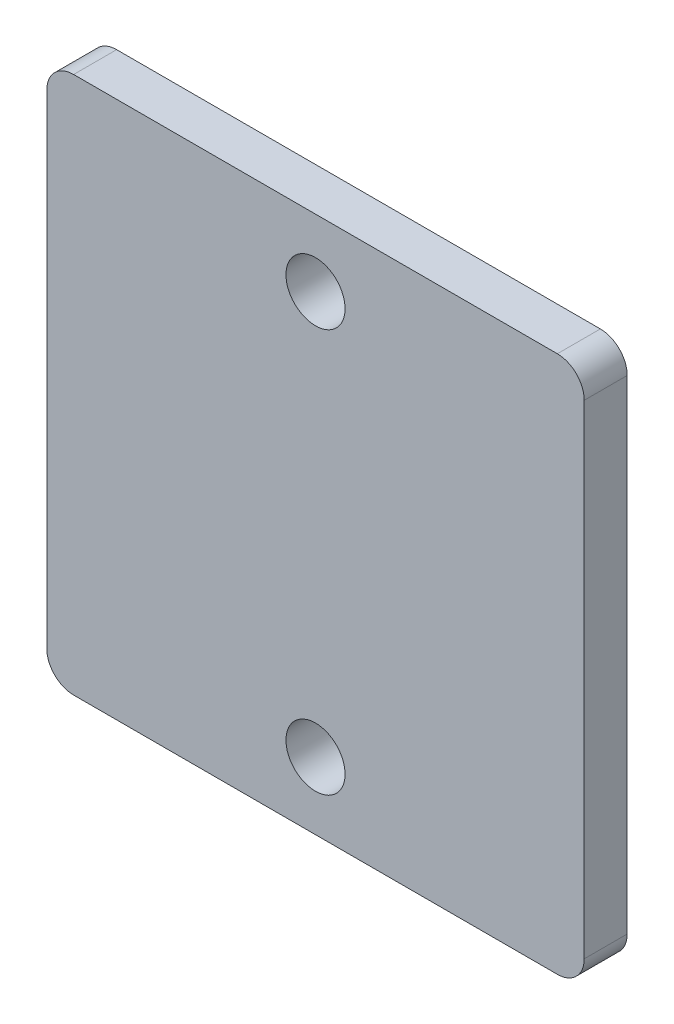
from build123d import *

# Parameters (mm, degrees)
SKETCH_1_R                             = 1.1
PCB20X20_T1P6_2NPTH_D2P2_PITCH15_DEPTH = 1.6


with BuildPart() as part:
    # 草图1 → PCB20x20_T1p6_2NPTH_D2p2_pitch15 (new body)
    with BuildSketch(Plane.XY):
        with BuildLine():
            Line((-9, -10), (9, -10))
            ThreePointArc((9, -10), (9.707106781, -9.707106781), (10, -9))
            Line((10, -9), (10, 9))
            ThreePointArc((10, 9), (9.707106781, 9.707106781), (9, 10))
            Line((9, 10), (-9, 10))
            ThreePointArc((-9, 10), (-9.707106781, 9.707106781), (-10, 9))
            Line((-10, 9), (-10, -9))
            ThreePointArc((-10, -9), (-9.707106781, -9.707106781), (-9, -10))
        make_face()
        with Locations((0, -7.5)):
            Circle(SKETCH_1_R, mode=Mode.SUBTRACT)
        with Locations((0, 7.5)):
            Circle(SKETCH_1_R, mode=Mode.SUBTRACT)
    extrude(amount=PCB20X20_T1P6_2NPTH_D2P2_PITCH15_DEPTH)


solid = part.part
